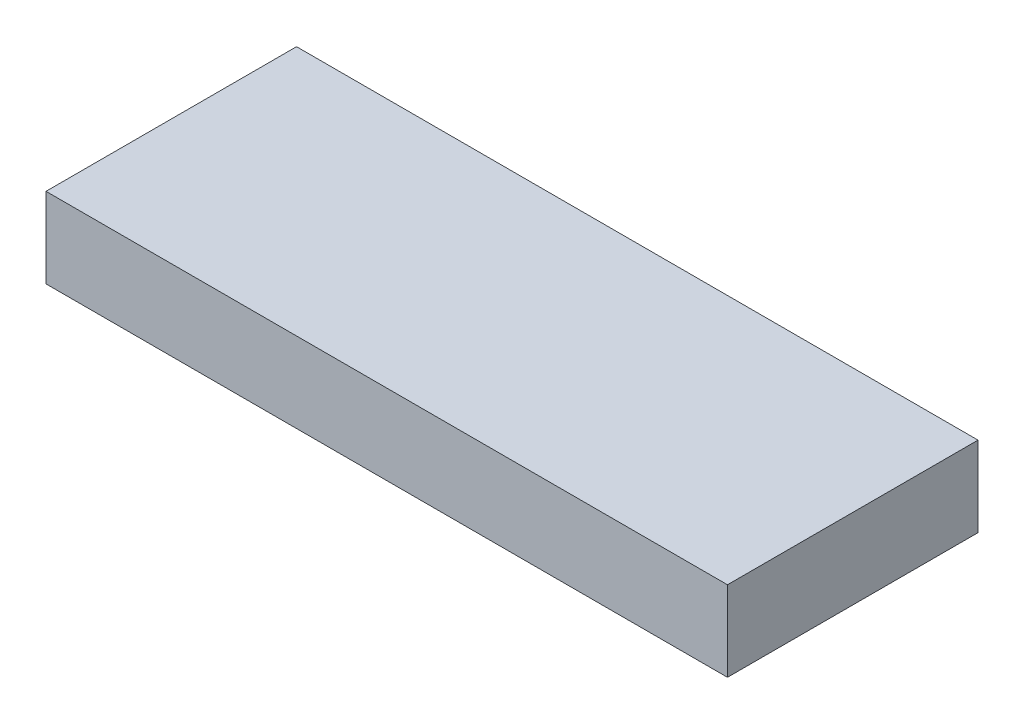
from build123d import *

# Parameters (mm, degrees)
SKETCH1_W           = 68
SKETCH1_H           = 25
BOSS_EXTRUDE1_DEPTH = 8


with BuildPart() as part:
    # Sketch1 → Boss-Extrude1 (new body)
    with BuildSketch(Plane(origin=(0, 0, 0), x_dir=(1, 0, 0), z_dir=(0, 1, 0))):
        with Locations((-34, 12.5)):
            Rectangle(SKETCH1_W, SKETCH1_H)
    extrude(amount=BOSS_EXTRUDE1_DEPTH)


solid = part.part
